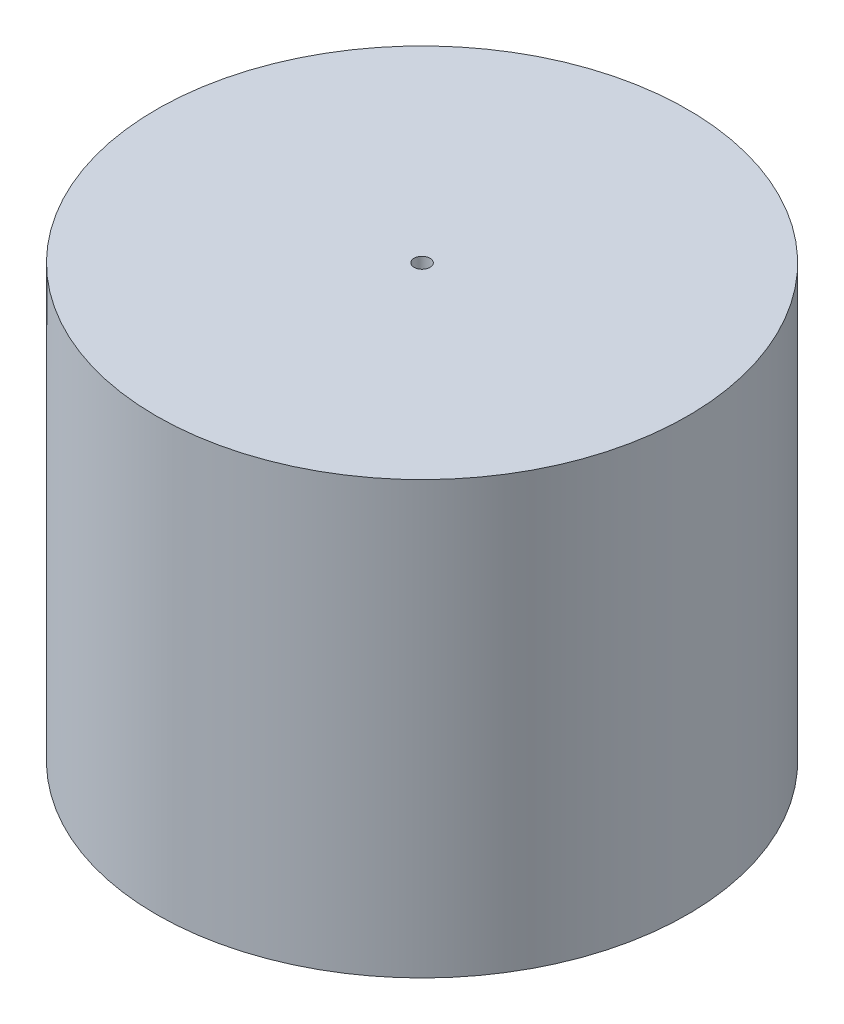
from build123d import *

# Parameters (mm, degrees)
SKETCH1_R           = 20
BOSS_EXTRUDE1_DEPTH = 7.5
SKETCH2_R           = 20
SKETCH2_R_2         = 12.5
BOSS_EXTRUDE2_DEPTH = 15
SKETCH3_R           = 20
BOSS_EXTRUDE3_DEPTH = 10
CUT_EXTRUDE2_DEPTH  = 5
CUT_EXTRUDE3_DEPTH  = 44.084219849
SKETCH6_R           = 8
CUT_EXTRUDE4_DEPTH  = 5
SKETCH7_R           = 2.1
CUT_EXTRUDE5_DEPTH  = 4.5
SKETCH8_R           = 0.6
CUT_EXTRUDE6_DEPTH  = 41.868692174
FILLET1_R           = 1.5


with BuildPart() as part:
    # Sketch1 → Boss-Extrude1 (new body)
    with BuildSketch(Plane(origin=(0, 0, 0), x_dir=(1, 0, 0), z_dir=(0, 1, 0))):
        with Locations(Location((0, 0, 0), (0, 0, 270))):
            Circle(SKETCH1_R)
    extrude(amount=-BOSS_EXTRUDE1_DEPTH)

    # Sketch2 → Boss-Extrude2 (add)
    with BuildSketch(Plane.XZ.offset(7.5)):
        with Locations(Location((0, 0, 0), (0, 0, 90))):
            Circle(SKETCH2_R)
        with Locations(Location((0, 0, 0), (0, 0, 270))):
            Circle(SKETCH2_R_2, mode=Mode.SUBTRACT)
    extrude(amount=BOSS_EXTRUDE2_DEPTH)

    # Sketch3 → Boss-Extrude3 (add)
    with BuildSketch(Plane.XZ.offset(22.5)):
        with Locations(Location((0, 0, 0), (0, 0, 90))):
            Circle(SKETCH3_R)
    extrude(amount=BOSS_EXTRUDE3_DEPTH)

    # Sketch4 → Cut-Extrude2 (cut)
    with BuildSketch(Plane(origin=(0, -22.5, 0), x_dir=(-1, 0, 0), z_dir=(0, -1, 0))):
        Polygon((10.164510853, 5.47869076), (0.337570049, 11.542069996), (-9.826940805, 6.063379236), (-10.164510853, -5.47869076), (-0.337570049, -11.542069996), (9.826940805, -6.063379236), align=None)
    extrude(amount=CUT_EXTRUDE2_DEPTH, mode=Mode.SUBTRACT)

    # Sketch5 → Cut-Extrude3 (cut, through all)
    with BuildSketch(Plane(origin=(0, 0, 0), x_dir=(0, 0, -1), z_dir=(1, 0, 0))):
        Polygon((7.5, -17.5), (12.5, -17.5), (12.5, -7.5), (-12.5, -7.5), (-12.5, -17.5), (-7.5, -17.5), (-7.5, -32.5), (7.5, -32.5), align=None)
    extrude(amount=-CUT_EXTRUDE3_DEPTH, mode=Mode.SUBTRACT)

    # Sketch6 → Cut-Extrude4 (cut)
    with BuildSketch(Plane.XZ.offset(32.5)):
        Circle(SKETCH6_R)
    extrude(amount=-CUT_EXTRUDE4_DEPTH, mode=Mode.SUBTRACT)

    # Sketch7 → Cut-Extrude5 (cut)
    with BuildSketch(Plane.XZ.offset(7.5)):
        with Locations(Location((0, 0, 0), (0, 0, 270))):
            Circle(SKETCH7_R)
    extrude(amount=-CUT_EXTRUDE5_DEPTH, mode=Mode.SUBTRACT)

    # Sketch8 → Cut-Extrude6 (cut, through all)
    with BuildSketch(Plane.XZ.offset(3)):
        with Locations(Location((0, 0, 0), (0, 0, 270))):
            Circle(SKETCH8_R)
    extrude(amount=-CUT_EXTRUDE6_DEPTH, mode=Mode.SUBTRACT)

    # Fillet1
    fillet1_edges = [part.edges().sort_by_distance(p)[0] for p in [
        (0, -7.5, 2.1),
    ]]
    fillet(fillet1_edges, radius=FILLET1_R)


solid = part.part
